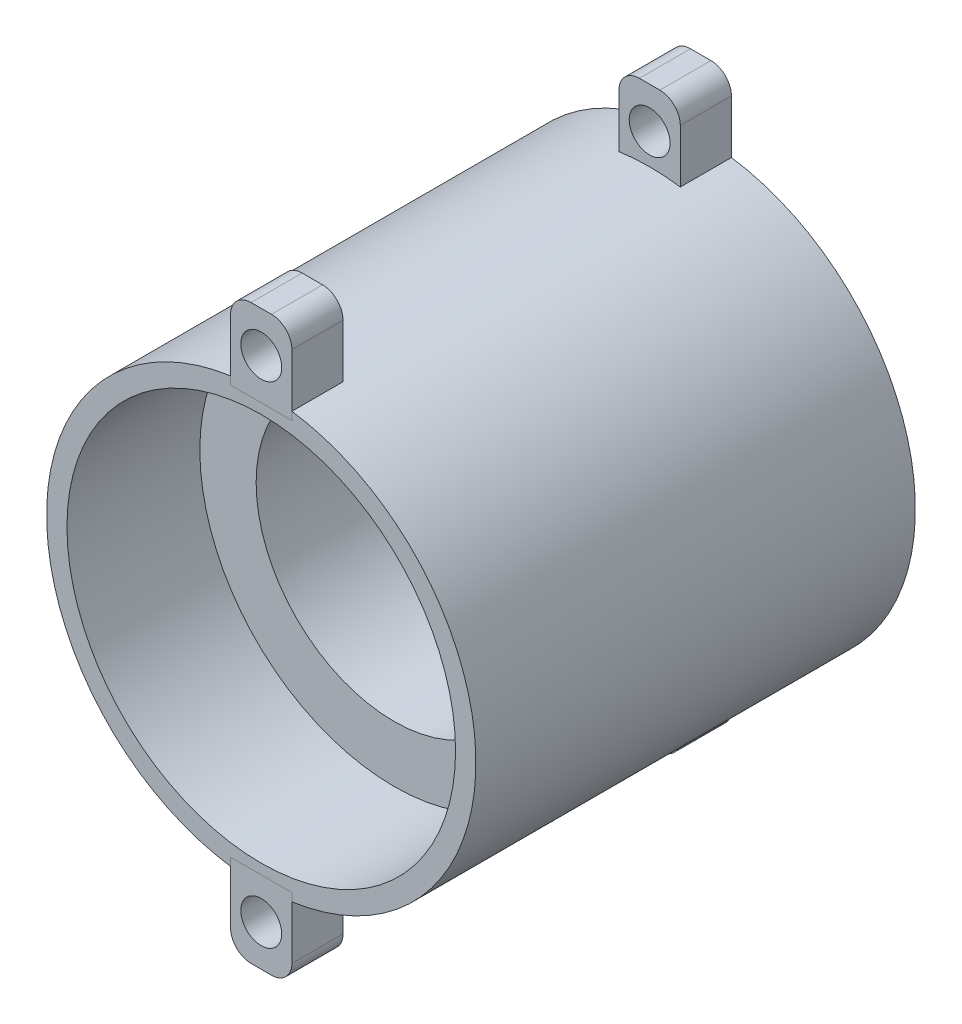
from build123d import *

# Parameters (mm, degrees)
SKETCH1_R                = 19.01
SKETCH1_R_2              = 13.5
BOSS_EXTRUDE1_DEPTH      = 30
BOSS_EXTRUDE2_DEPTH      = 13
BOSS_EXTRUDE2_DEPTH_BACK = 30
SKETCH2_R                = 21
SKETCH2_R_2              = 19.01
CUT_EXTRUDE1_DEPTH       = 28
MIRROR2_COPY_1_DEPTH     = 28
BOSS_EXTRUDE3_START      = -5
SKETCH4_W                = 6
SKETCH4_H                = 8
SKETCH4_R                = 2
BOSS_EXTRUDE3_DEPTH      = 5.0001
FILLET1_R                = 2
FILLET1_OF_MIRROR5_R     = 2
BOSS_EXTRUDE6_START      = 0.0001
SKETCH7_W                = 6
SKETCH7_H                = 8
SKETCH7_R                = 2
BOSS_EXTRUDE6_DEPTH      = 5.0001
FILLET2_R                = 2


with BuildPart() as part:
    # Sketch1 → Boss-Extrude1 (new body)
    with BuildSketch(Plane.XY):
        Circle(SKETCH1_R)
        Circle(SKETCH1_R_2, mode=Mode.SUBTRACT)
    extrude(amount=BOSS_EXTRUDE1_DEPTH)

    # Sketch2 → Boss-Extrude2 (add, two sides: drawn at the far end of the back side and taken through both)
    with BuildSketch(Plane.XY.offset(30).offset(-BOSS_EXTRUDE2_DEPTH_BACK)):
        Circle(SKETCH2_R)
        Circle(SKETCH2_R_2, mode=Mode.SUBTRACT)
    extrude(amount=BOSS_EXTRUDE2_DEPTH + BOSS_EXTRUDE2_DEPTH_BACK)

    # Sketch3 → Cut-Extrude1 (cut)
    with BuildSketch(Plane(origin=(0, 0, 0), x_dir=(-1, 0, 0), z_dir=(0, 0, -1))):
        Polygon((15.540276616, 12.01617991), (10.937752349, 10.062524267), (14.845063634, 0.857475733), (19.447587901, 2.811131375), align=None)
    cut_extrude1 = extrude(amount=-CUT_EXTRUDE1_DEPTH, mode=Mode.SUBTRACT)

    # Mirror1: Cut-Extrude1 across plane
    add(cut_extrude1.mirror(Plane.ZX), mode=Mode.SUBTRACT)

    # Mirror2: Cut-Extrude1 across plane
    add(cut_extrude1.mirror(Plane(origin=(0, 0, 0), x_dir=(0, 0, 1), z_dir=(1, 0, 0))), mode=Mode.SUBTRACT)

    # Mirror2 copy 1 sketch → Mirror2 copy 1 (cut)
    with BuildSketch(Plane(origin=(0, 0, 0), x_dir=(1, 0, 0), z_dir=(0, 0, -1))):
        Polygon((15.540276616, 12.01617991), (10.937752349, 10.062524267), (14.845063634, 0.857475733), (19.447587901, 2.811131375), align=None)
    extrude(amount=-MIRROR2_COPY_1_DEPTH, mode=Mode.SUBTRACT)

    # Sketch4 → Boss-Extrude3 (add)
    with BuildSketch(Plane(origin=(0, 0, 0), x_dir=(-1, 0, 0), z_dir=(0, 0, -1)).offset(BOSS_EXTRUDE3_START)):
        with Locations((0, 24)):
            Rectangle(SKETCH4_W, SKETCH4_H)
        with Locations((0, 24)):
            Circle(SKETCH4_R, mode=Mode.SUBTRACT)
    boss_extrude3 = extrude(amount=BOSS_EXTRUDE3_DEPTH)

    # Fillet1
    fillet1_edges = [part.edges().sort_by_distance(p)[0] for p in [
        (-3, 28, 2.49995),
        (3, 28, 2.49995),
    ]]
    fillet(fillet1_edges, radius=FILLET1_R)

    # Mirror5: Boss-Extrude3 across plane
    add(boss_extrude3.mirror(Plane.ZX))

    # Fillet1 of Mirror5
    fillet1_of_mirror5_edges = [part.edges().sort_by_distance(p)[0] for p in [
        (-3, -28, 2.49995),
        (3, -28, 2.49995),
    ]]
    fillet(fillet1_of_mirror5_edges, radius=FILLET1_OF_MIRROR5_R)

    # Sketch7 → Boss-Extrude6 (add)
    with BuildSketch(Plane.XY.offset(43).offset(BOSS_EXTRUDE6_START)):
        with Locations((0, 24)):
            Rectangle(SKETCH7_W, SKETCH7_H)
        with Locations(Location((0, 24, 0), (0, 0, 180))):
            Circle(SKETCH7_R, mode=Mode.SUBTRACT)
    boss_extrude6 = extrude(amount=-BOSS_EXTRUDE6_DEPTH)

    # Mirror6: Boss-Extrude6 across plane
    add(boss_extrude6.mirror(Plane.ZX))

    # Fillet2
    fillet2_edges = [part.edges().sort_by_distance(p)[0] for p in [
        (-3, 28, 40.50005),
        (3, 28, 40.50005),
        (-3, -28, 40.50005),
        (3, -28, 40.50005),
    ]]
    fillet(fillet2_edges, radius=FILLET2_R)


solid = part.part
